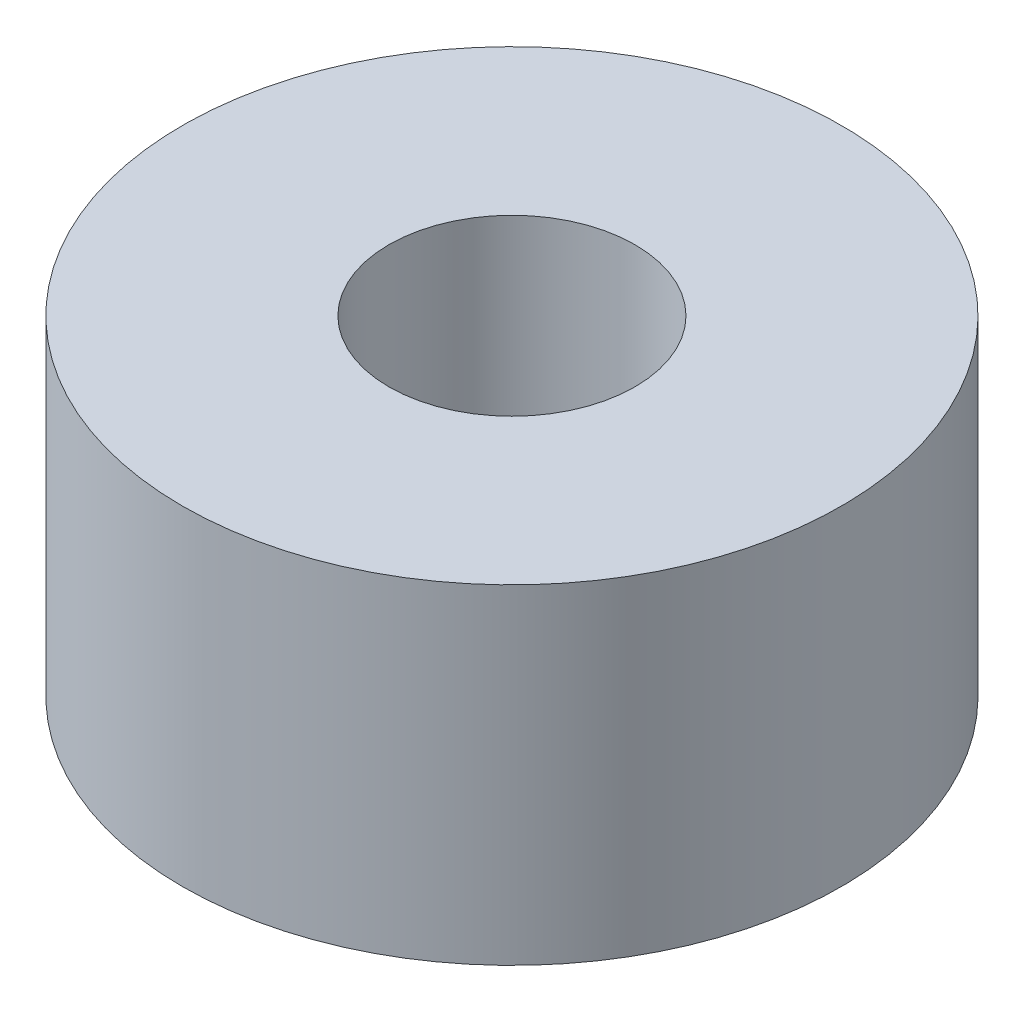
from build123d import *

# Parameters (mm, degrees)
SKETCH_2_R      = 8.5
SKETCH_2_R_2    = 3.175
EXTRUDE_1_DEPTH = 8.5


with BuildPart() as part:
    # Эскиз2 → Вытянуть1 (new body)
    with BuildSketch(Plane(origin=(0, 0, 0), x_dir=(1, 0, 0), z_dir=(0, 1, 0))):
        with Locations(Location((0, 0, 0), (0, 0, 270))):
            Circle(SKETCH_2_R)
        with Locations(Location((0, 0, 0), (0, 0, 270))):
            Circle(SKETCH_2_R_2, mode=Mode.SUBTRACT)
    extrude(amount=EXTRUDE_1_DEPTH)


solid = part.part
